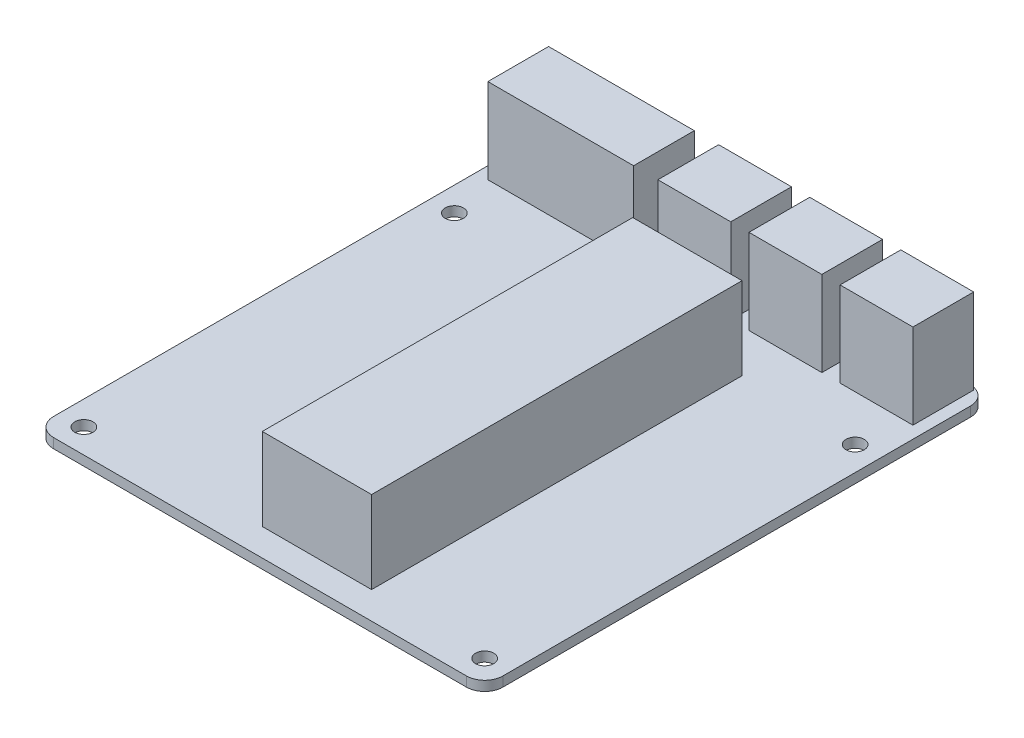
from build123d import *

# Parameters (mm, degrees)
BOSS_EXTRUDE1_DEPTH     = 1.6
CUT_EXTRUDE1_DEPTH      = 56.62202801
CUT_EXTRUDE1_DEPTH_BACK = 56.62202801
SKETCH3_R               = 1.5
SKETCH4_W               = 24
SKETCH4_H               = 10
SKETCH4_W_2             = 12
BOSS_EXTRUDE2_DEPTH     = 14
SKETCH5_W               = 18
SKETCH5_H               = 61
BOSS_EXTRUDE3_DEPTH     = 13.56


with BuildPart() as part:
    # Sketch2 → Boss-Extrude1 (new body)
    with BuildSketch(Plane(origin=(0, 0, 0), x_dir=(1, 0, 0), z_dir=(0, 1, 0))):
        with BuildLine():
            Line((34, 41.5), (-34, 41.5))
            ThreePointArc((-34, 41.5), (-36.121320344, 40.621320344), (-37, 38.5))
            Line((-37, 38.5), (-37, -38.5))
            ThreePointArc((-37, -38.5), (-36.121320344, -40.621320344), (-34, -41.5))
            Line((-34, -41.5), (34, -41.5))
            ThreePointArc((34, -41.5), (36.121320344, -40.621320344), (37, -38.5))
            Line((37, -38.5), (37, 38.5))
            ThreePointArc((37, 38.5), (36.121320344, 40.621320344), (34, 41.5))
        make_face()
    extrude(amount=BOSS_EXTRUDE1_DEPTH)

    # Sketch3 → Cut-Extrude1 (cut, two sides: drawn at the far end of the back side and taken through both)
    with BuildSketch(Plane(origin=(0, 1.6, 0), x_dir=(1, 0, 0), z_dir=(0, 1, 0)).offset(-CUT_EXTRUDE1_DEPTH_BACK)):
        with Locations(Location((-33, 23.5, 0), (0, 0, 270))):
            Circle(SKETCH3_R)
        with Locations(Location((33, 23.5, 0), (0, 0, 270))):
            Circle(SKETCH3_R)
        with Locations(Location((-33, -37.5, 0), (0, 0, 270))):
            Circle(SKETCH3_R)
        with Locations(Location((33, -37.5, 0), (0, 0, 270))):
            Circle(SKETCH3_R)
    extrude(amount=CUT_EXTRUDE1_DEPTH + CUT_EXTRUDE1_DEPTH_BACK, mode=Mode.SUBTRACT)

    # Sketch4 → Boss-Extrude2 (add)
    with BuildSketch(Plane(origin=(0, 1.6, 0), x_dir=(1, 0, 0), z_dir=(0, 1, 0))):
        with Locations((-23, 36.022367187)):
            Rectangle(SKETCH4_W, SKETCH4_H)
        with Locations((-1, 36.022367187)):
            Rectangle(SKETCH4_W_2, SKETCH4_H)
        with Locations((14, 36.022367187)):
            Rectangle(SKETCH4_W_2, SKETCH4_H)
        with Locations((29, 36.022367187)):
            Rectangle(SKETCH4_W_2, SKETCH4_H)
    extrude(amount=BOSS_EXTRUDE2_DEPTH)

    # Sketch5 → Boss-Extrude3 (add)
    with BuildSketch(Plane(origin=(0, 1.6, 0), x_dir=(1, 0, 0), z_dir=(0, 1, 0))):
        with Locations((4.88, -6.5)):
            Rectangle(SKETCH5_W, SKETCH5_H)
    extrude(amount=BOSS_EXTRUDE3_DEPTH)


solid = part.part
